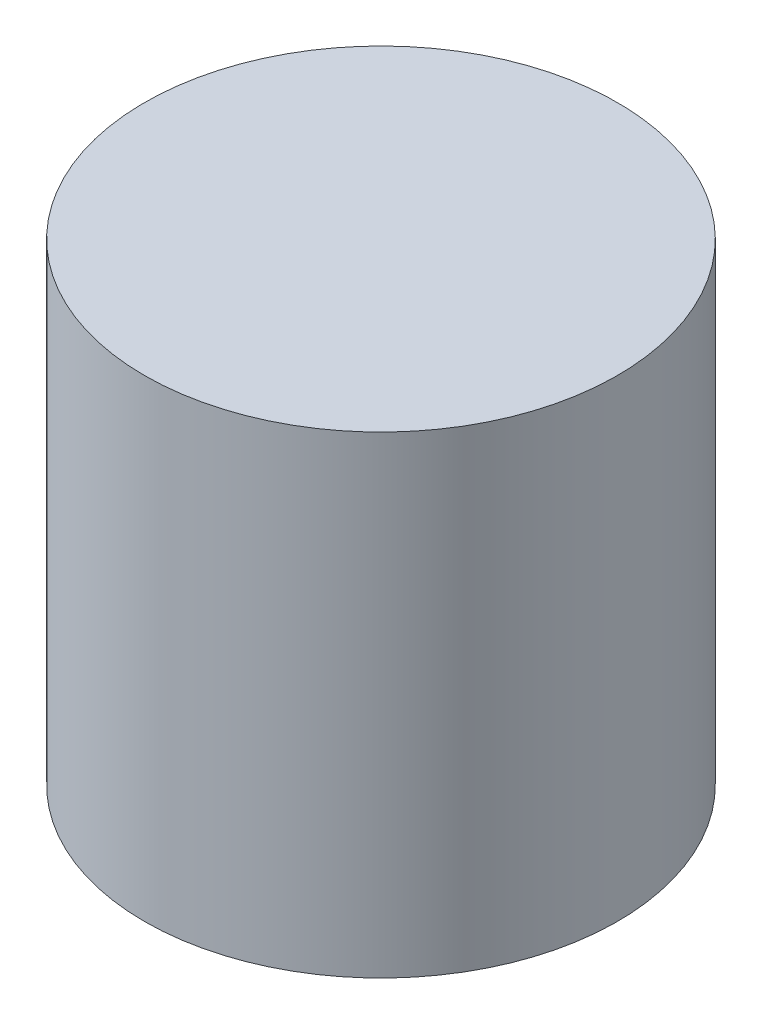
from build123d import *

# Parameters (mm, degrees)
ESQUISSE1_R        = 3
BOSS_EXTRU_1_DEPTH = 6


with BuildPart() as part:
    # Esquisse1 → Boss.-Extru.1 (new body)
    with BuildSketch(Plane(origin=(0, 0, 0), x_dir=(1, 0, 0), z_dir=(0, 1, 0))):
        with Locations(Location((0, 0, 0), (0, 0, 270))):
            Circle(ESQUISSE1_R)
    extrude(amount=BOSS_EXTRU_1_DEPTH)


solid = part.part
